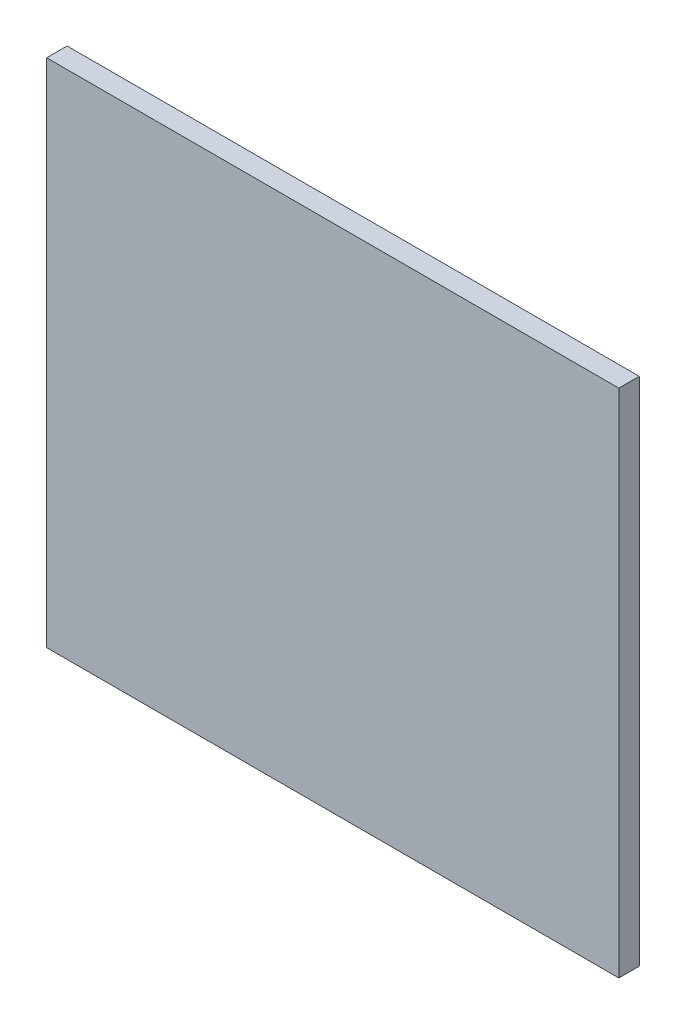
from build123d import *

# Parameters (mm, degrees)
SKETCH1_W           = 177.8
SKETCH1_H           = 158.75
BOSS_EXTRUDE1_DEPTH = 6.35


with BuildPart() as part:
    # Sketch1 → Boss-Extrude1 (new body)
    with BuildSketch(Plane.XY):
        Rectangle(SKETCH1_W, SKETCH1_H)
    extrude(amount=BOSS_EXTRUDE1_DEPTH)


solid = part.part
